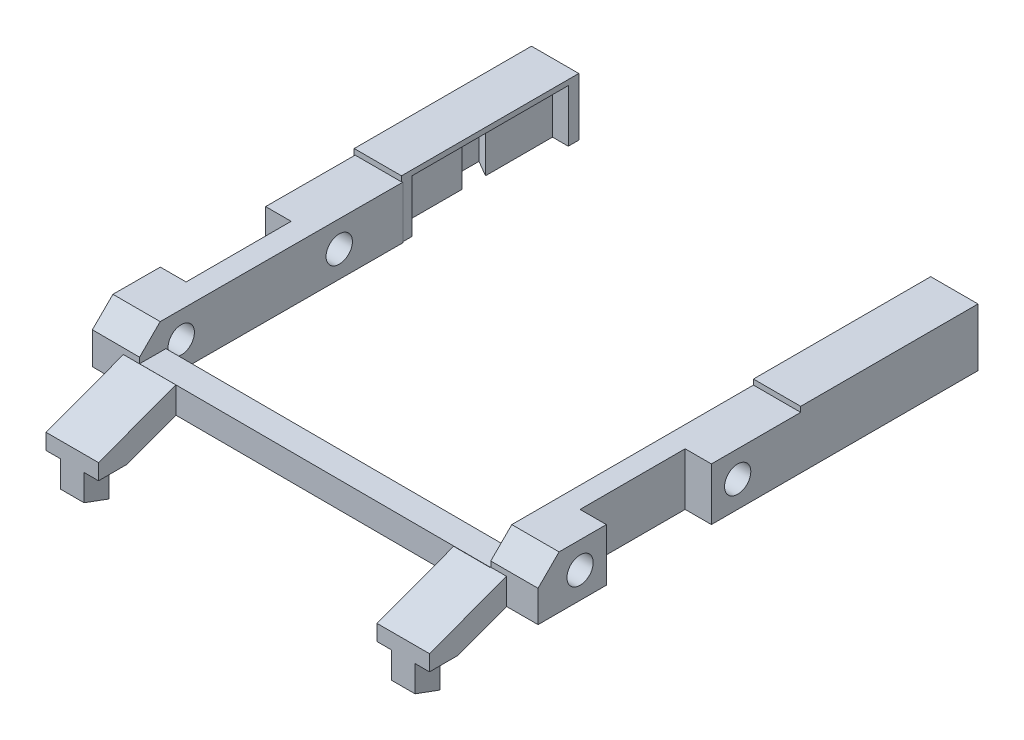
from build123d import *

# Parameters (mm, degrees)
EXTRUDE_3_DEPTH     = 10
EXTRUDE_3_2_DEPTH   = 10
CUT_EXTRUDE_1_DEPTH = 10
SKETCH_5_W          = 9
SKETCH_5_H          = 33.75
EXTRUDE_4_DEPTH     = 1
EXTRUDE_START       = -1
SKETCH_6_W          = 9
SKETCH_6_H          = 50
EXTRUDE_5_DEPTH     = 10
CUT_EXTRUDE_2_DEPTH = 109.615218202
EXTRUDE_6_REACH     = 103.613
SKETCH_8_W          = 5
SKETCH_8_H          = 5
EXTRUDE_7_DEPTH     = 10
EXTRUDE_START_2     = -10
EXTRUDE_8_DEPTH     = 10
EXTRUDE_9_DEPTH     = 5
SKETCH_12_W         = 5
SKETCH_12_H         = 20
CUT_EXTRUDE_3_DEPTH = 10
SKETCH_13_R         = 2.5
CUT_EXTRUDE_4_DEPTH = 120.224997159


with BuildPart() as part:
    # Эскиз3 → Бобышка-Вытянуть3 (new body)
    with BuildSketch(Plane(origin=(0, 0, 0), x_dir=(1, 0, 0), z_dir=(0, 1, 0))):
        Polygon((-33.5, 14.875), (-33.5, 16.875), (-42.5, 16.875), (-42.5, -16.875), (-33.5, -16.875), (-33.5, -14.875), (-36.5, -14.875), (-36.5, 14.875), align=None)
    extrude(amount=-EXTRUDE_3_DEPTH)


with BuildPart() as body_2:
    # Эскиз3 → Extrude 3 2 (new body)
    with BuildSketch(Plane(origin=(0, 0, 0), x_dir=(1, 0, 0), z_dir=(0, 1, 0))):
        Polygon((36.5, 14.875), (33.5, 14.875), (33.5, 16.875), (42.5, 16.875), (42.5, -16.875), (33.5, -16.875), (33.5, -14.875), (36.5, -14.875), align=None)
    extrude(amount=-EXTRUDE_3_2_DEPTH)


with BuildPart() as cut_extrude_1_tool:
    # Эскиз4 → Вырез-Вытянуть1 (new body)
    with BuildSketch(Plane(origin=(0, 0, 0), x_dir=(1, 0, 0), z_dir=(0, 1, 0))):
        Polygon((-36.5, 2.125), (-39.5, 3.875), (-39.5, -4.125), (-36.5, -2.375), align=None)
        Polygon((36.5, -2.375), (36.5, 2.125), (39.5, 3.875), (39.5, -4.125), align=None)
    extrude(amount=-CUT_EXTRUDE_1_DEPTH)


with BuildPart() as part_1:
    add(part.part)

    # Вырез-Вытянуть1: cut by cut_extrude_1_tool
    add(cut_extrude_1_tool.part, mode=Mode.SUBTRACT)



with BuildPart() as body_2_1:
    add(body_2.part)

    # Вырез-Вытянуть1: cut by cut_extrude_1_tool
    add(cut_extrude_1_tool.part, mode=Mode.SUBTRACT)


with BuildPart() as part_2:
    add(part_1.part)

    add(body_2_1.part)  # Бобышка-Вытянуть4 merges body 2
    # Эскиз5 → Бобышка-Вытянуть4 (add)
    with BuildSketch(Plane(origin=(0, 0, 0), x_dir=(1, 0, 0), z_dir=(0, 1, 0))):
        with Locations((-38, 0)):
            Rectangle(SKETCH_5_W, SKETCH_5_H)
        with Locations((38, 0)):
            Rectangle(SKETCH_5_W, SKETCH_5_H)
    extrude(amount=EXTRUDE_4_DEPTH)

    # Эскиз6 → Бобышка-Вытянуть5 (add)
    with BuildSketch(Plane(origin=(0, 1, 0), x_dir=(1, 0, 0), z_dir=(0, 1, 0)).offset(EXTRUDE_START)):
        Polygon((-42.440780706, -66.770624684), (-33.440807885, -66.792743069), (-33.317927971, -16.792894064), (-42.317900792, -16.770775679), align=None)
        with Locations((38, -41.875)):
            Rectangle(SKETCH_6_W, SKETCH_6_H)
    extrude(amount=-EXTRUDE_5_DEPTH)

    # Эскиз7 → Вырез-Вытянуть2 (cut, through all)
    with BuildSketch(Plane(origin=(42.5, 0, 0), x_dir=(0, 0, -1), z_dir=(1, 0, 0))):
        Polygon((-62.875, 0), (-66.875, -4), (-66.875, 0), align=None)
    extrude(amount=-CUT_EXTRUDE_2_DEPTH, mode=Mode.SUBTRACT)

    # Бобышка-Вытянуть6: up to this plane
    extrude_6_end = Plane(origin=(33.5, -10, -14.875), z_dir=(-1, 0, 0))
    # Эскиз8 → Бобышка-Вытянуть6 (add, up to the surface)
    with BuildSketch(Plane(origin=(-33.276456675, 0, -0.08178041), x_dir=(0.0024575982770184833, 0, -0.9999969801007945), z_dir=(0.9999969801007945, 0, 0.0024575982770184833)), mode=Mode.PRIVATE) as extrude_6_sk1:
        with Locations((-64.374725433, -7.5)):
            Rectangle(SKETCH_8_W, SKETCH_8_H)
    extrude_6_tool1 = split(extrude(extrude_6_sk1.sketch, amount=EXTRUDE_6_REACH, mode=Mode.PRIVATE), bisect_by=extrude_6_end, keep=Keep.BOTH, mode=Mode.PRIVATE)
    add(extrude_6_tool1.solids().sort_by_distance((-33.434664, -7.5, 64.292751))[0])

    # Эскиз10 → Бобышка-Вытянуть8 (add)
    with BuildSketch(Plane(origin=(36.5, 0, 0), x_dir=(0, 0, -1), z_dir=(1, 0, 0)).offset(EXTRUDE_START_2)):
        Polygon((-81.544047558, -10.443650814), (-81.544047558, -13.443650814), (-76.13067803, -13.443650814), (-66.809800838, -10), (-66.809800838, -5), align=None)
    extrude(amount=EXTRUDE_8_DEPTH)



with BuildPart() as body_2_2:
    # Эскиз9 → Бобышка-Вытянуть7 (new body)
    with BuildSketch(Plane(origin=(-26.5, 0, 0), x_dir=(0, 0, -1), z_dir=(1, 0, 0))):
        Polygon((-81.544047558, -13.443650814), (-81.544047558, -10.443650814), (-66.809800838, -5), (-66.809800838, -10), (-76.13067803, -13.443650814), align=None)
    extrude(amount=-EXTRUDE_7_DEPTH)


with BuildPart() as part_3:
    add(part_2.part)

    add(body_2_2.part)  # Бобышка-Вытянуть9 merges body 2 2
    # Эскиз11 → Бобышка-Вытянуть9 (add)
    with BuildSketch(Plane.XZ.offset(13.443650814)):
        Polygon((-33.75, 81.544047558), (-35.5, 78.544047558), (-27.5, 78.544047558), (-29.25, 81.544047558), align=None)
        Polygon((27.5, 78.544047558), (35.5, 78.544047558), (33.75, 81.544047558), (29.25, 81.544047558), align=None)
    extrude(amount=EXTRUDE_9_DEPTH)

    # Эскиз12 → Вырез-Вытянуть3 (cut)
    with BuildSketch(Plane(origin=(0, 0, 0), x_dir=(1, 0, 0), z_dir=(0, 1, 0))):
        with Locations((40, -43.875)):
            Rectangle(SKETCH_12_W, SKETCH_12_H)
        with Locations((-40, -43.875)):
            Rectangle(SKETCH_12_W, SKETCH_12_H)
    extrude(amount=-CUT_EXTRUDE_3_DEPTH, mode=Mode.SUBTRACT)

    # Эскиз13 → Вырез-Вытянуть4 (cut, through all)
    with BuildSketch(Plane(origin=(42.5, 0, 0), x_dir=(0, 0, -1), z_dir=(1, 0, 0))):
        with Locations((-58.875, -5)):
            Circle(SKETCH_13_R)
        with Locations((-28.875, -5)):
            Circle(SKETCH_13_R)
    extrude(amount=-CUT_EXTRUDE_4_DEPTH, mode=Mode.SUBTRACT)


solid = part_3.part
